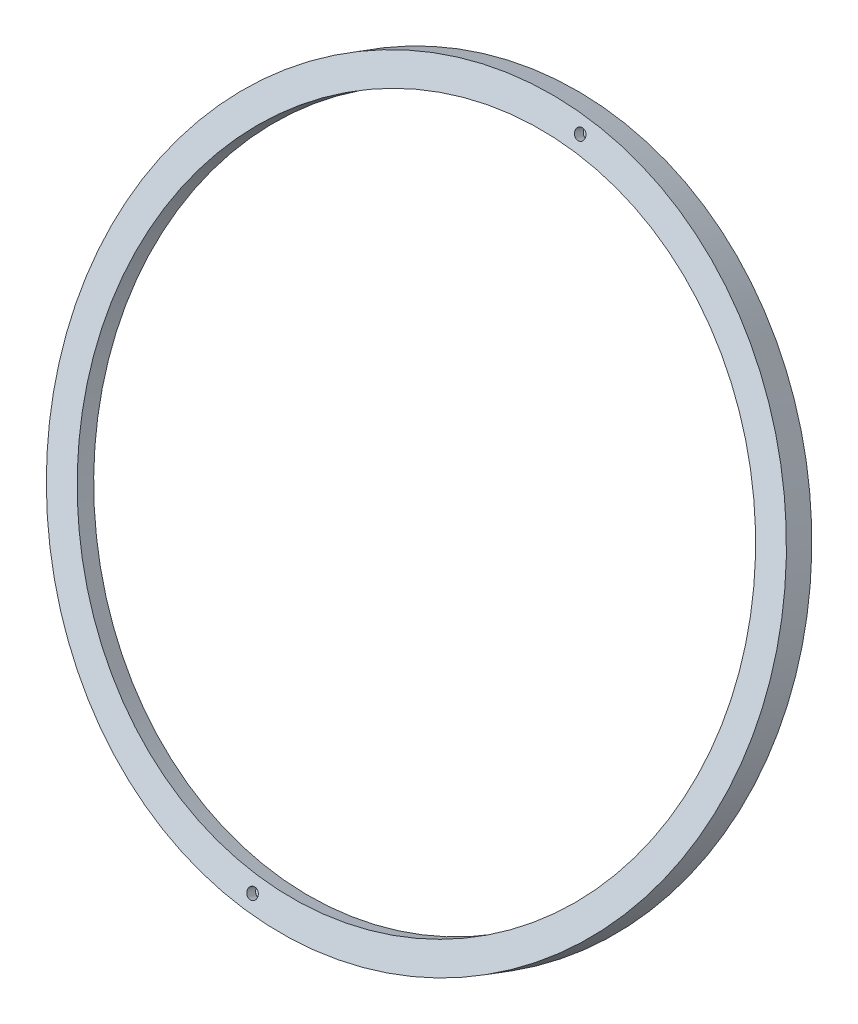
from build123d import *

# Parameters (mm, degrees)
PER_AGE1_D                   = 1.5
PER_AGE1_DEPTH               = 1.5
R_P_TITION_CIRCULAIRE1_COUNT = 2
PER_AGE3_D                   = 88
PER_AGE3_DEPTH               = 41.419450184
PER_AGE3_CBORE_D             = 92
PER_AGE3_CBORE_DEPTH         = 1.5


with BuildPart() as part:
    # Esquisse1 → Révolution1 (revolve)
    with BuildSketch(Plane(origin=(0, -1.422218517, 0.591043356), x_dir=(-1, 0, 0), z_dir=(0, 0.923433296037535, -0.38375897093000255)), mode=Mode.PRIVATE) as r_volution1_sk:
        Polygon((-40.385642644, 380.524269691), (7.521954057, 383.501210806), (7.255269748, 387.792933011), (-40.652326952, 384.815991896), align=None)
    revolve(r_volution1_sk.sketch.rotate(Axis((-7.683193189, 144.754032103, 352.33270189), (0.062019606567244694, 0.3830202085297531, 0.9216556234619678)), 270), axis=Axis((-7.683193189, 144.754032103, 352.33270189), (0.062019606567244694, 0.3830202085297531, 0.9216556234619678)))

    # Perçage1
    with Locations(Plane(origin=(23.97655886, 148.074247526, 356.308779232), x_dir=(0.9980749312557872, -0.023800580393729533, -0.05727096971134188), z_dir=(0.062019606567244694, 0.3830202085297554, 0.9216556234619669))):
        with Locations((-25.264524434, 44.063242824)):
            per_age1 = Hole(PER_AGE1_D / 2, depth=PER_AGE1_DEPTH)

    # Répétition circulaire1: Perçage1 ×2 about axis
    r_p_tition_circulaire1_axis = Axis((-31.231828608, -0.677449137, 2.383170434), (0.062019606567244756, 0.3830202085297553, 0.9216556234619669))
    for i in range(1, R_P_TITION_CIRCULAIRE1_COUNT):
        add(per_age1.rotate(r_p_tition_circulaire1_axis, i * 360 / R_P_TITION_CIRCULAIRE1_COUNT), mode=Mode.SUBTRACT)

    # Perçage3
    with Locations(Plane(origin=(23.709874552, 146.42726063, 352.345660051), x_dir=(-0.9980749312557872, 0.023800580393729533, 0.05727096971134188), z_dir=(-0.062019606567244694, -0.3830202085297554, -0.9216556234619669))):
        with Locations((31.29206799, -1.540142123)):
            CounterBoreHole(PER_AGE3_D / 2, PER_AGE3_CBORE_D / 2, PER_AGE3_CBORE_DEPTH, depth=PER_AGE3_DEPTH)


solid = part.part
